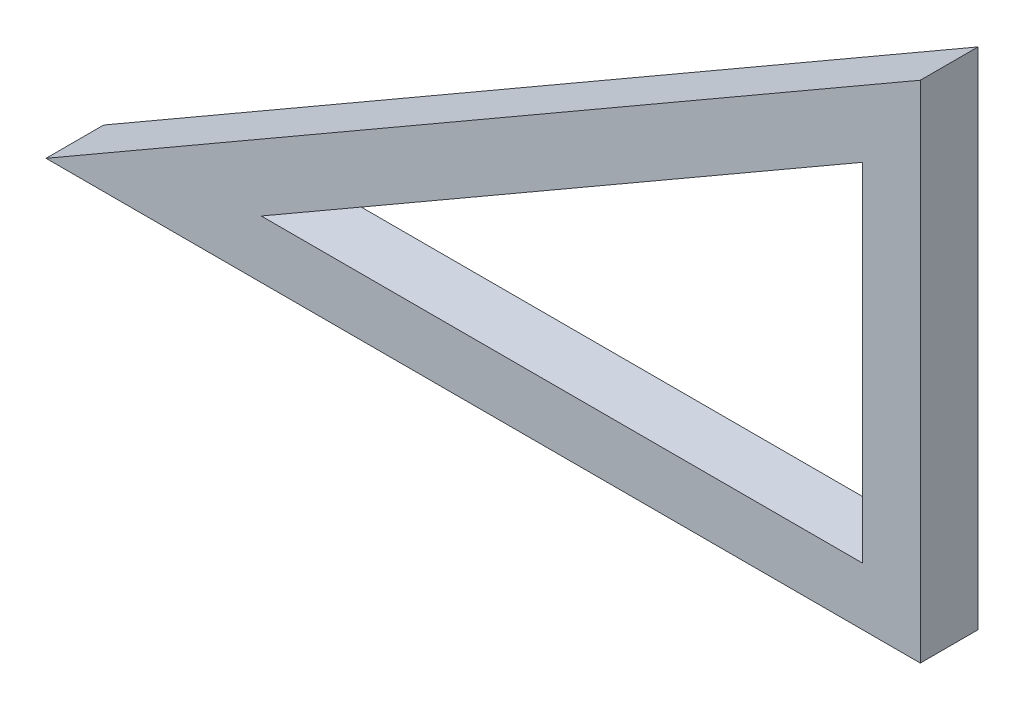
from build123d import *

# Parameters (mm, degrees)
BOSS_EXTRUDE1_DEPTH = 20


with BuildPart() as part:
    # Sketch1 → Boss-Extrude1 (new body)
    with BuildSketch(Plane.XY):
        Polygon((0, 0), (303.108891325, 0), (303.108891325, 175), align=None)
        Polygon((283.108891325, 140.358983849), (74.641016151, 20), (283.108891325, 20), align=None, mode=Mode.SUBTRACT)
    extrude(amount=BOSS_EXTRUDE1_DEPTH)


solid = part.part
